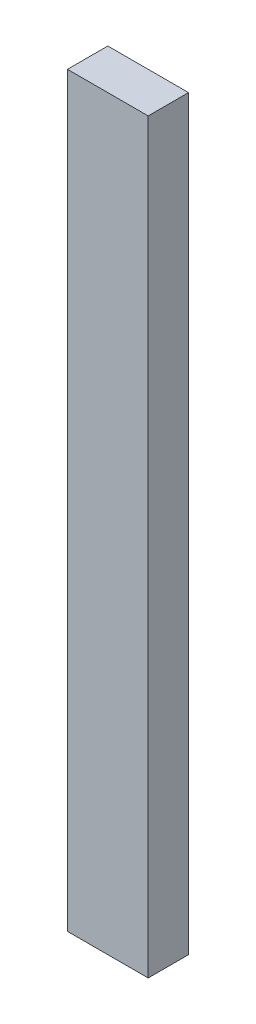
from build123d import *

# Parameters (mm, degrees)
SKETCH1_W           = 40
SKETCH1_H           = 20
BOSS_EXTRUDE1_DEPTH = 370


with BuildPart() as part:
    # Sketch1 → Boss-Extrude1 (new body)
    with BuildSketch(Plane(origin=(0, 0, 0), x_dir=(1, 0, 0), z_dir=(0, 1, 0))):
        with Locations((-217.333333333, 65)):
            Rectangle(SKETCH1_W, SKETCH1_H)
    extrude(amount=BOSS_EXTRUDE1_DEPTH)


solid = part.part
